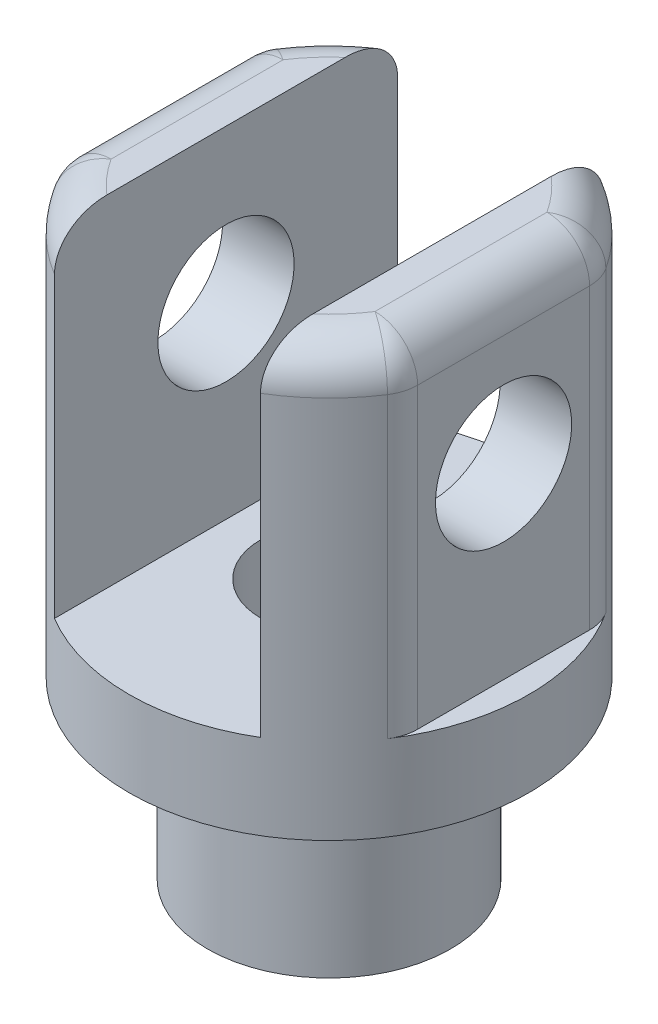
from build123d import *

# Parameters (mm, degrees)
SKETCH1_R           = 7.14375
BOSS_EXTRUDE1_DEPTH = 10.25
SKETCH2_R           = 11.75
BOSS_EXTRUDE2_DEPTH = 25
SKETCH6_R           = 4
CUT_EXTRUDE4_DEPTH  = 20
CUT_EXTRUDE5_START  = -20
CUT_EXTRUDE5_DEPTH  = 20
SKETCH7_R           = 4
CUT_EXTRUDE6_DEPTH  = 30
FILLET1_R           = 2.5
FILLET2_R           = 2.5


with BuildPart() as part:
    # Sketch1 → Boss-Extrude1 (new body)
    with BuildSketch(Plane(origin=(0, 0, 0), x_dir=(1, 0, 0), z_dir=(0, 1, 0))):
        with Locations(Location((0, 0, 0), (0, 0, 270))):
            Circle(SKETCH1_R)
    extrude(amount=BOSS_EXTRUDE1_DEPTH)

    # Sketch2 → Boss-Extrude2 (add)
    with BuildSketch(Plane(origin=(0, 10.25, 0), x_dir=(1, 0, 0), z_dir=(0, 1, 0))):
        with Locations(Location((0, 0, 0), (0, 0, 270))):
            Circle(SKETCH2_R)
    extrude(amount=BOSS_EXTRUDE2_DEPTH)

    # Sketch6 → Cut-Extrude4 (cut)
    with BuildSketch(Plane.XZ):
        with Locations(Location((0, 0, 0), (0, 0, 270))):
            Circle(SKETCH6_R)
    extrude(amount=-CUT_EXTRUDE4_DEPTH, mode=Mode.SUBTRACT)

    # Sketch3 → Cut-Extrude5 (cut)
    with BuildSketch(Plane(origin=(0, 35.25, 0), x_dir=(1, 0, 0), z_dir=(0, 1, 0)).offset(CUT_EXTRUDE5_START)):
        with BuildLine():
            ThreePointArc((6.05, 10.072735478), (0, 11.75), (-6.05, 10.072735478))
            Line((-6.05, 10.072735478), (-6.05, -10.072735478))
            ThreePointArc((-6.05, -10.072735478), (0, -11.75), (6.05, -10.072735478))
            Line((6.05, -10.072735478), (6.05, 10.072735478))
        make_face()
        with BuildLine():
            Line((-10.25, -5.744562647), (-10.25, 5.744562647))
            ThreePointArc((-10.25, 5.744562647), (-11.75, 0), (-10.25, -5.744562647))
        make_face()
        with BuildLine():
            ThreePointArc((11.75, 0), (11.368817001, 2.968585522), (10.25, 5.744562647))
            Line((10.25, 5.744562647), (10.25, -5.744562647))
            ThreePointArc((10.25, -5.744562647), (11.368817001, -2.968585522), (11.75, 0))
        make_face()
    extrude(amount=CUT_EXTRUDE5_DEPTH, mode=Mode.SUBTRACT)

    # Sketch7 → Cut-Extrude6 (cut)
    with BuildSketch(Plane.ZY.offset(10.25)):
        with Locations((0, 26.25)):
            Circle(SKETCH7_R)
    extrude(amount=-CUT_EXTRUDE6_DEPTH, mode=Mode.SUBTRACT)

    # Fillet1
    fillet1_edges = [part.edges().sort_by_distance(p)[0] for p in [
        (10.25, 25.25, -5.744562647),
        (10.25, 25.25, 5.744562647),
        (-10.25, 25.25, -5.744562647),
        (-10.25, 25.25, 5.744562647),
    ]]
    fillet(fillet1_edges, radius=FILLET1_R)

    # Fillet2
    fillet2_edges = [part.edges().sort_by_distance(p)[0] for p in [
        (-8.155066755, 35.25, -8.4591599),
        (8.155066755, 35.25, 8.4591599),
        (8.155066755, 35.25, -8.4591599),
        (-8.155066755, 35.25, 8.4591599),
        (10.25, 35.25, 0),
        (10.146506466, 35.25, -5.761620966),
        (10.146506466, 35.25, 5.761620966),
        (-10.25, 35.25, 0),
        (-10.146506466, 35.25, -5.761620966),
        (-10.146506466, 35.25, 5.761620966),
    ]]
    fillet(fillet2_edges, radius=FILLET2_R)


solid = part.part
